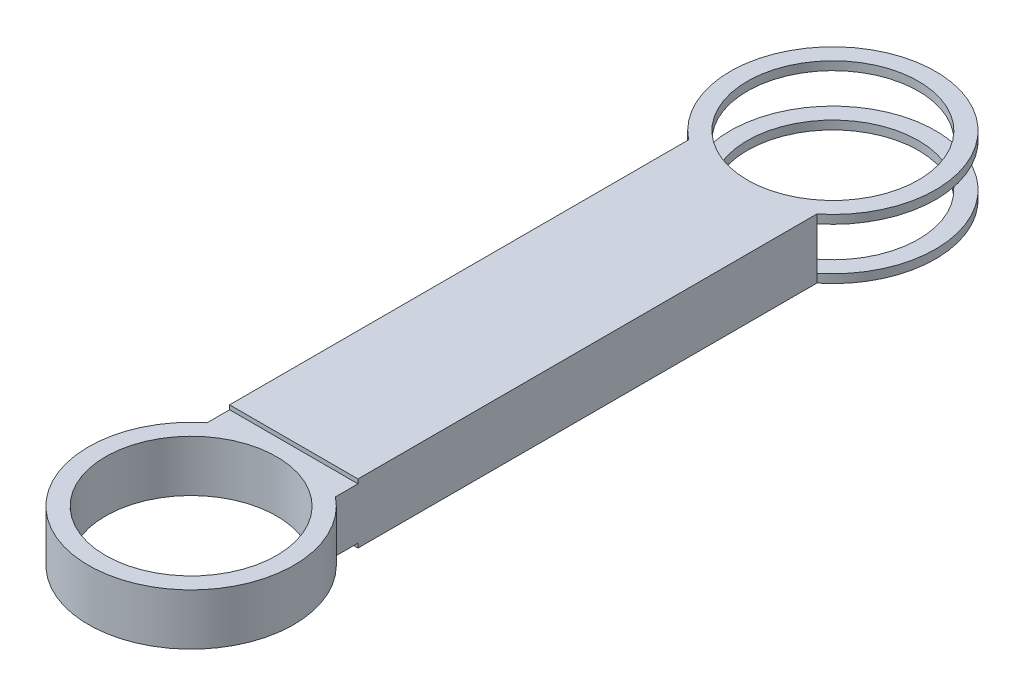
from build123d import *

# Parameters (mm, degrees)
PROFILE_SKETCH_R                  = 10
PROFILE_EXTRUDE_DEPTH             = 7
UPPER_WRIST_CUT_DEPTH             = 0.5
LOWER_START                       = 6.5
LOWER_WRIST_CUT_DEPTH             = 0.5
FINGER_CUT_REACH                  = 53.413
FINGER_CUT_END_RADIUS             = 12
FINGER_CUT_SKETCH_W               = 23.367496998
FINGER_CUT_SKETCH_H               = 5
FINGER_CUT_DIRECTION_2_REACH      = 53.413
FINGER_CUT_DIRECTION_2_END_RADIUS = 12


with BuildPart() as part:
    # Profile Sketch → Profile Extrude (new body)
    with BuildSketch(Plane(origin=(0, 0, 0), x_dir=(1, 0, 0), z_dir=(0, 1, 0))):
        with BuildLine():
            Line((-7.5, 28.132503002), (-7.5, -28.132503002))
            ThreePointArc((-7.5, -28.132503002), (0, -49.5), (7.5, -28.132503002))
            Line((7.5, -28.132503002), (7.5, 28.132503002))
            ThreePointArc((7.5, 28.132503002), (0, 49.5), (-7.5, 28.132503002))
        make_face()
        with Locations(Location((0, -37.5, 0), (0, 0, 270))):
            Circle(PROFILE_SKETCH_R, mode=Mode.SUBTRACT)
        with Locations(Location((0, 37.5, 0), (0, 0, 270))):
            Circle(PROFILE_SKETCH_R, mode=Mode.SUBTRACT)
    extrude(amount=PROFILE_EXTRUDE_DEPTH)

    # Wrist Cut Sketch → Upper Wrist Cut (cut)
    with BuildSketch(Plane(origin=(0, 0, 0), x_dir=(1, 0, 0), z_dir=(0, 1, 0))):
        with BuildLine():
            Line((-7.5, -28.132503002), (-7.5, -25.5))
            Line((-7.5, -25.5), (7.5, -25.5))
            Line((7.5, -25.5), (7.5, -28.132503002))
            ThreePointArc((7.5, -28.132503002), (0, -49.5), (-7.5, -28.132503002))
        make_face()
    extrude(amount=UPPER_WRIST_CUT_DEPTH, mode=Mode.SUBTRACT)

    # Sketch2<2> → Lower Wrist Cut (cut)
    with BuildSketch(Plane(origin=(0, 0, 0), x_dir=(1, 0, 0), z_dir=(0, 1, 0)).offset(LOWER_START)):
        with BuildLine():
            Line((-7.5, -28.132503002), (-7.5, -25.5))
            Line((-7.5, -25.5), (7.5, -25.5))
            Line((7.5, -25.5), (7.5, -28.132503002))
            ThreePointArc((7.5, -28.132503002), (0, -49.5), (-7.5, -28.132503002))
        make_face()
    extrude(amount=LOWER_WRIST_CUT_DEPTH, mode=Mode.SUBTRACT)

    # Finger Cut: up to this cylinder (the profile starts inside it)
    finger_cut_end = Plane(origin=(0, 3.5, -37.5), z_dir=(0, -1, 0)) * Cylinder(FINGER_CUT_END_RADIUS, 131.826, mode=Mode.PRIVATE)
    # Finger Cut Sketch → Finger Cut (cut, up to the surface)
    with BuildSketch(Plane(origin=(0, 0, 0), x_dir=(0, 0, -1), z_dir=(1, 0, 0)), mode=Mode.PRIVATE) as finger_cut_sk1:
        with Locations((37.816251501, 3.5)):
            Rectangle(FINGER_CUT_SKETCH_W, FINGER_CUT_SKETCH_H)
    finger_cut_tool1 = extrude(finger_cut_sk1.sketch, amount=-FINGER_CUT_REACH, mode=Mode.PRIVATE) & finger_cut_end
    add(finger_cut_tool1.solids().sort_by_distance((0, 3.5, -37.816252))[0], mode=Mode.SUBTRACT)

    # Finger Cut direction 2: up to this cylinder (the profile starts inside it)
    finger_cut_direction_2_end = Plane(origin=(0, 3.5, -37.5), z_dir=(0, -1, 0)) * Cylinder(FINGER_CUT_DIRECTION_2_END_RADIUS, 131.826, mode=Mode.PRIVATE)
    # Finger Cut Sketch → Finger Cut direction 2 (cut, up to the surface)
    with BuildSketch(Plane(origin=(0, 0, 0), x_dir=(0, 0, -1), z_dir=(1, 0, 0)), mode=Mode.PRIVATE) as finger_cut_direction_2_sk1:
        with Locations((37.816251501, 3.5)):
            Rectangle(FINGER_CUT_SKETCH_W, FINGER_CUT_SKETCH_H)
    finger_cut_direction_2_tool1 = extrude(finger_cut_direction_2_sk1.sketch, amount=FINGER_CUT_DIRECTION_2_REACH, mode=Mode.PRIVATE) & finger_cut_direction_2_end
    add(finger_cut_direction_2_tool1.solids().sort_by_distance((0, 3.5, -37.816252))[0], mode=Mode.SUBTRACT)


solid = part.part
